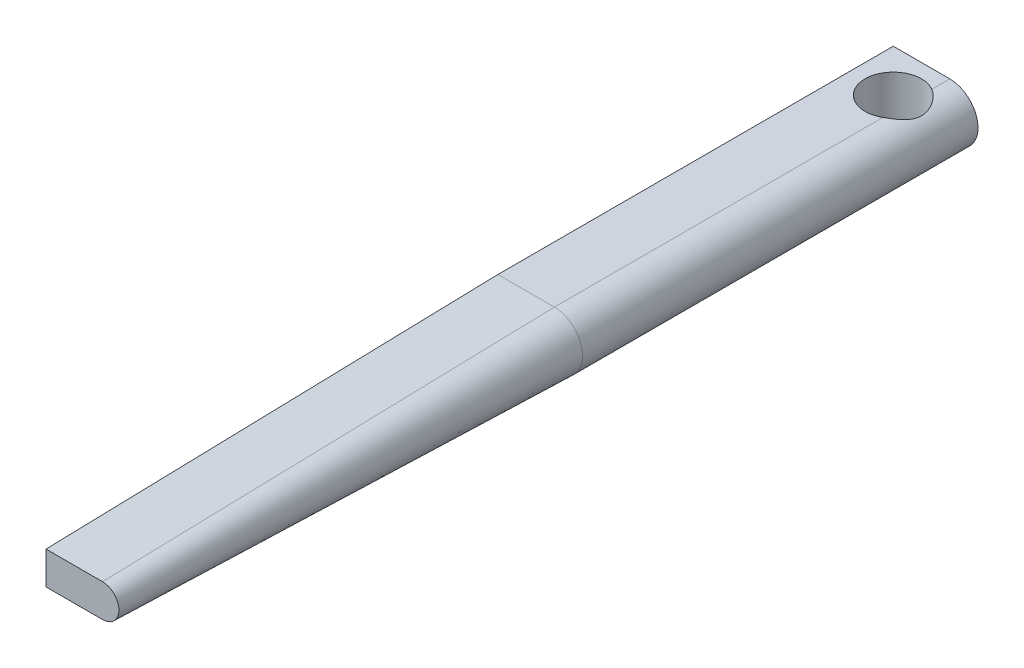
from build123d import *
from OCP.BRepFilletAPI import BRepFilletAPI_MakeChamfer

# Parameters (mm, degrees)
EXTRUDE_1_DEPTH     = 150
SKETCH_2_R          = 5
CUT_EXTRUDE_2_DEPTH = 152.079449297
CHAMFER_1_SIZE      = 80
CHAMFER_1_SIZE2     = 2.094873726


with BuildPart() as part:
    # 草图1 → 拉伸1 (new body)
    with BuildSketch(Plane.XY):
        with BuildLine():
            Line((0, 10), (10, 10))
            ThreePointArc((10, 10), (15, 5), (10, 0))
            Line((10, 0), (0, 0))
            Line((0, 0), (0, 10))
        make_face()
    extrude(amount=EXTRUDE_1_DEPTH)

    # 草图2 → 拉伸2 (cut, through all)
    with BuildSketch(Plane(origin=(0, 10, 0), x_dir=(1, 0, 0), z_dir=(0, 1, 0))):
        with Locations(Location((7.5, -7.5, 0), (0, 0, 300))):
            Circle(SKETCH_2_R)
    extrude(amount=-CUT_EXTRUDE_2_DEPTH, mode=Mode.SUBTRACT)

    # 倒角1: one chamfer whose edges measure the first distance from different faces: ONE call of the kernel's chamfer builder (chamfer() names one face for all edges)
    chamfer_1_edges_1 = [part.edges().sort_by_distance(p)[0] for p in [
        (15, 5, 150),
    ]]
    chamfer_1_side_1 = [part.faces().sort_by_distance(p)[0] for p in [
        (15, 5, 75),
    ]]
    chamfer_1_edges_2 = [part.edges().sort_by_distance(p)[0] for p in [
        (5, 10, 150),
    ]]
    chamfer_1_side_2 = [part.faces().sort_by_distance(p)[0] for p in [
        (4.927731535, 10, 77.968371884),
    ]]
    chamfer_1_edges_3 = [part.edges().sort_by_distance(p)[0] for p in [
        (5, 0, 150),
    ]]
    chamfer_1_side_3 = [part.faces().sort_by_distance(p)[0] for p in [
        (4.927731535, 0, 77.968371884),
    ]]
    chamfer_1 = BRepFilletAPI_MakeChamfer(part.part.solid().wrapped)
    for e in chamfer_1_edges_1:
        chamfer_1.Add(CHAMFER_1_SIZE, CHAMFER_1_SIZE2, e.wrapped, chamfer_1_side_1[0].wrapped)  # the first distance lies on this face
    for e in chamfer_1_edges_2:
        chamfer_1.Add(CHAMFER_1_SIZE, CHAMFER_1_SIZE2, e.wrapped, chamfer_1_side_2[0].wrapped)  # the first distance lies on this face
    for e in chamfer_1_edges_3:
        chamfer_1.Add(CHAMFER_1_SIZE, CHAMFER_1_SIZE2, e.wrapped, chamfer_1_side_3[0].wrapped)  # the first distance lies on this face
    add(Compound.cast(chamfer_1.Shape()), mode=Mode.REPLACE)


solid = part.part
